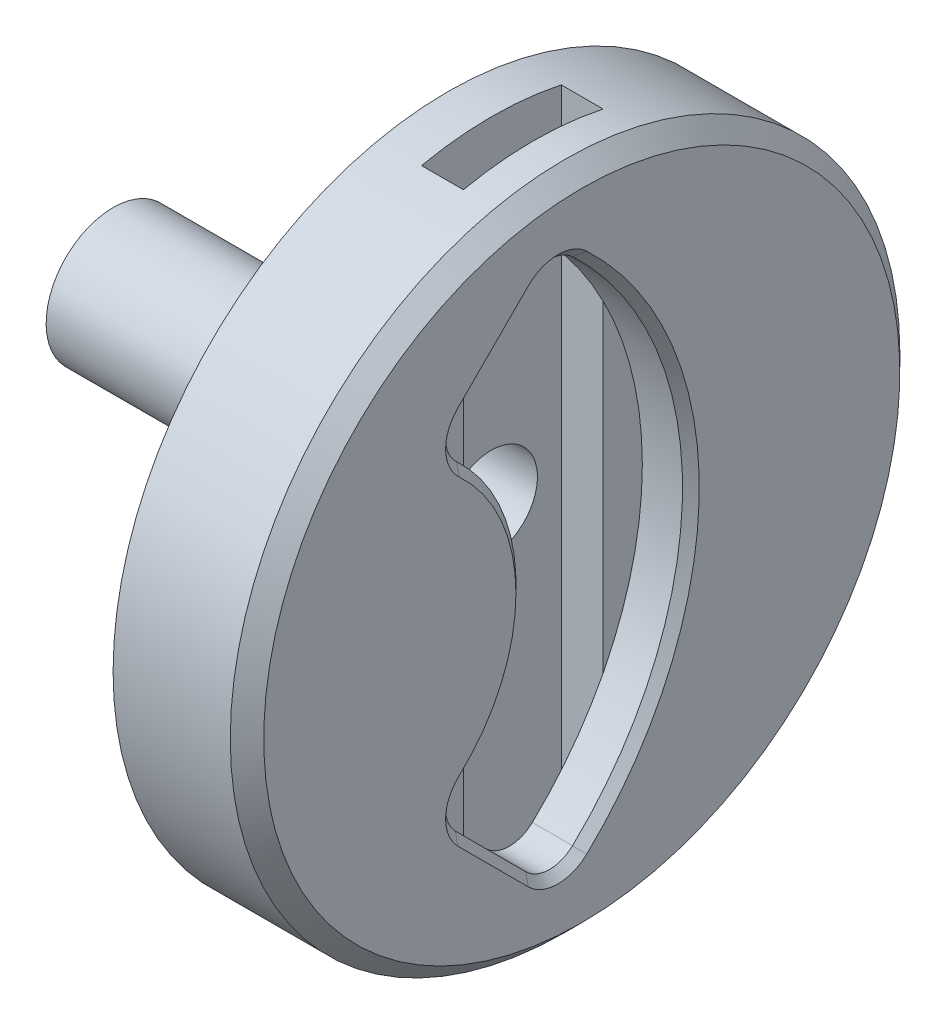
from build123d import *

# Parameters (mm, degrees)
CORTAR_EXTRUIR1_DEPTH = 2.9
REDONDEO1_R           = 10
CORTAR_EXTRUIR2_REACH = 41.799
CROQUIS3_R            = 1.75
CROQUIS4_R            = 2.75
CORTAR_EXTRUIR3_DEPTH = 22.1
CHAFL_N1_SIZE         = 1
CHAFL_N2_SIZE         = 0.5
CROQUIS6_W            = 2.5
CROQUIS6_H            = 8.35
CORTAR_EXTRUIR5_DEPTH = 25


with BuildPart() as part:
    # Croquis1 → Revolución1 (revolve)
    with BuildSketch(Plane.XY):
        Polygon((-20, 0), (-20, 4), (0, 4), (0, 20), (8, 20), (8, 0), align=None)
    revolve(axis=Axis((8, 0, 0), (-1, 0, 0)))

    # Croquis2 → Cortar-Extruir1 (cut)
    with BuildSketch(Plane(origin=(8, 0, 0), x_dir=(0, 0, -1), z_dir=(1, 0, 0))):
        with BuildLine():
            Line((-2.839199656, 15.194118815), (-7.049029232, 10.984289239))
            ThreePointArc((-7.049029232, 10.984289239), (-7.634375098, 9.528098398), (-6.988431485, 8.097756342))
            ThreePointArc((-6.988431485, 8.097756342), (-3.433318471, 0), (-6.988431485, -8.097756342))
            ThreePointArc((-6.988431485, -8.097756342), (-7.634375098, -9.528098398), (-7.049029232, -10.984289239))
            Line((-7.049029232, -10.984289239), (-2.839199656, -15.194118815))
            ThreePointArc((-2.839199656, -15.194118815), (-1.453779812, -15.779697972), (-0.052075025, -15.234248815))
            ThreePointArc((-0.052075025, -15.234248815), (6.516681529, 0), (-0.052075025, 15.234248815))
            ThreePointArc((-0.052075025, 15.234248815), (-1.453779812, 15.779697972), (-2.839199656, 15.194118815))
        make_face()
    extrude(amount=-CORTAR_EXTRUIR1_DEPTH, mode=Mode.SUBTRACT)

    # Redondeo1
    redondeo1_edges = [part.edges().sort_by_distance(p)[0] for p in [
        (0, -4, 0),
    ]]
    fillet(redondeo1_edges, radius=REDONDEO1_R)

    # Croquis3 → Cortar-Extruir2 (cut, up to next)
    with BuildSketch(Plane.ZY.offset(20), mode=Mode.PRIVATE) as cortar_extruir2_sk1:
        with Locations(Location((0, 0, 0), (0, 0, 270))):
            Circle(CROQUIS3_R)
    cortar_extruir2_tool1 = extrude(cortar_extruir2_sk1.sketch, amount=-CORTAR_EXTRUIR2_REACH, mode=Mode.PRIVATE) & part.part
    add(cortar_extruir2_tool1.solids().sort_by_distance((-20, 0, 0))[0], mode=Mode.SUBTRACT)

    # Croquis4 → Cortar-Extruir3 (cut)
    with BuildSketch(Plane(origin=(5.1, 0, 0), x_dir=(0, 0, -1), z_dir=(1, 0, 0))):
        with Locations(Location((0, 0, 0), (0, 0, 90))):
            Circle(CROQUIS4_R)
    extrude(amount=-CORTAR_EXTRUIR3_DEPTH, mode=Mode.SUBTRACT)

    # Chaflán1
    chafl_n1_edges = [part.edges().sort_by_distance(p)[0] for p in [
        (8, -20, 0),
    ]]
    chamfer(chafl_n1_edges, length=CHAFL_N1_SIZE)

    # Chaflán2
    chafl_n2_edges = [part.edges().sort_by_distance(p)[0] for p in [
        (8, -15.779697972, 1.453779812),
        (8, 0, -6.516681529),
        (8, 15.779697972, 1.453779812),
        (8, 13.089204027, 4.944114444),
        (8, 9.528098398, 7.634375098),
        (8, 0, 3.433318471),
        (8, -9.528098398, 7.634375098),
        (8, -13.089204027, 4.944114444),
    ]]
    chamfer(chafl_n2_edges, length=CHAFL_N2_SIZE)

    # Croquis6 → Cortar-Extruir5 (cut, symmetric)
    with BuildSketch(Plane(origin=(0, 0, 0), x_dir=(1, 0, 0), z_dir=(0, 1, 0))):
        with Locations((3.85, 0)):
            Rectangle(CROQUIS6_W, CROQUIS6_H)
    extrude(amount=CORTAR_EXTRUIR5_DEPTH, both=True, mode=Mode.SUBTRACT)


solid = part.part
